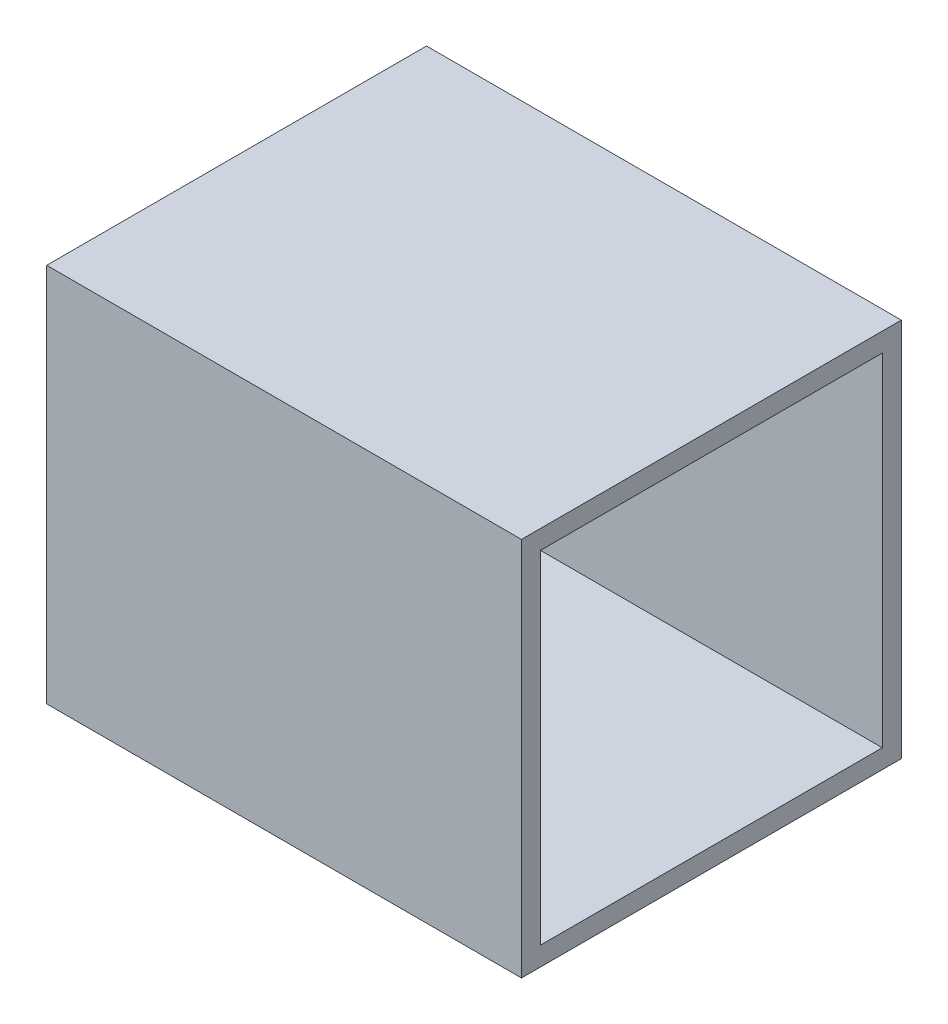
from build123d import *

# Parameters (mm, degrees)
SKETCH1_W           = 254
SKETCH1_H           = 254
BOSS_EXTRUDE1_DEPTH = 12.7
SKETCH2_W           = 254
SKETCH2_H           = 254
SKETCH2_W_2         = 228.6
SKETCH2_H_2         = 228.6
BOSS_EXTRUDE2_DEPTH = 304.8


with BuildPart() as part:
    # Sketch1 → Boss-Extrude1 (new body)
    with BuildSketch(Plane(origin=(0, 0, 0), x_dir=(0, 0, -1), z_dir=(1, 0, 0))):
        with Locations((127, 127)):
            Rectangle(SKETCH1_W, SKETCH1_H)
    extrude(amount=BOSS_EXTRUDE1_DEPTH)

    # Sketch2 → Boss-Extrude2 (add)
    with BuildSketch(Plane(origin=(12.7, 0, 0), x_dir=(0, 0, -1), z_dir=(1, 0, 0))):
        with Locations((127, 127)):
            Rectangle(SKETCH2_W, SKETCH2_H)
        with Locations((127, 127)):
            Rectangle(SKETCH2_W_2, SKETCH2_H_2, mode=Mode.SUBTRACT)
    extrude(amount=BOSS_EXTRUDE2_DEPTH)


solid = part.part
